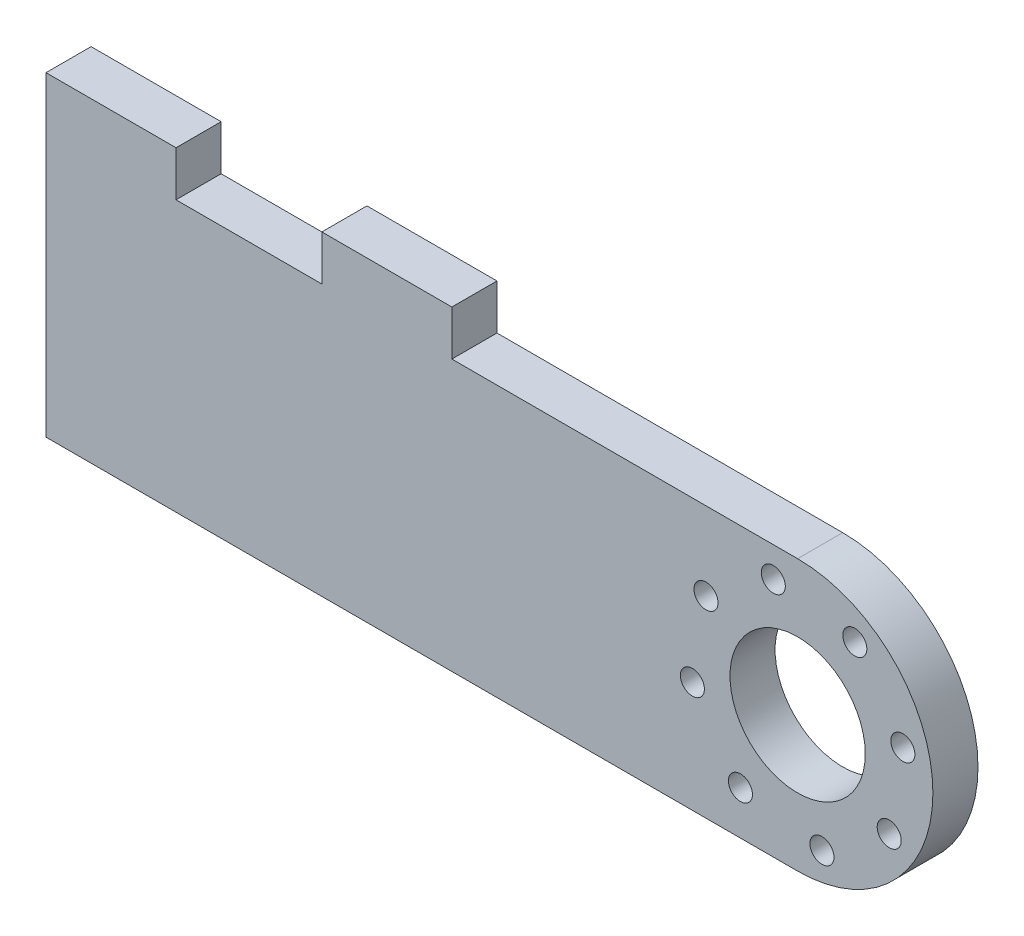
from build123d import *

# Parameters (mm, degrees)
ESQUISSE1_R        = 4.5
ESQUISSE1_R_2      = 0.8
BOSS_EXTRU_1_DEPTH = 3


with BuildPart() as part:
    # Esquisse1 → Boss.-Extru.1 (new body)
    with BuildSketch(Plane.XY):
        with BuildLine():
            Line((1.597834667, 9), (24.597834667, 9))
            ThreePointArc((24.597834667, 9), (33.597834667, 0), (24.597834667, -9))
            Line((24.597834667, -9), (-25.402165333, -9))
            Line((-25.402165333, -9), (-25.402165333, 12))
            Line((-25.402165333, 12), (-16.752165333, 12))
            Line((-16.752165333, 12), (-16.752165333, 9))
            Line((-16.752165333, 9), (-7.052165333, 9))
            Line((-7.052165333, 9), (-7.052165333, 12))
            Line((-7.052165333, 12), (1.597834667, 12))
            Line((1.597834667, 12), (1.597834667, 9))
        make_face()
        with Locations((24.597834667, 0)):
            Circle(ESQUISSE1_R, mode=Mode.SUBTRACT)
        with Locations((22.97907079, 7)):
            Circle(ESQUISSE1_R_2, mode=Mode.SUBTRACT)
        with Locations((28.402943221, 6.094386383)):
            Circle(ESQUISSE1_R_2, mode=Mode.SUBTRACT)
        with Locations((31.597834667, 1.618763877)):
            Circle(ESQUISSE1_R_2, mode=Mode.SUBTRACT)
        with Locations((30.69222105, -3.805108554)):
            Circle(ESQUISSE1_R_2, mode=Mode.SUBTRACT)
        with Locations((26.216598544, -7)):
            Circle(ESQUISSE1_R_2, mode=Mode.SUBTRACT)
        with Locations((20.792726113, -6.094386383)):
            Circle(ESQUISSE1_R_2, mode=Mode.SUBTRACT)
        with Locations((17.597834667, -1.618763877)):
            Circle(ESQUISSE1_R_2, mode=Mode.SUBTRACT)
        with Locations((18.503448284, 3.805108554)):
            Circle(ESQUISSE1_R_2, mode=Mode.SUBTRACT)
    extrude(amount=BOSS_EXTRU_1_DEPTH)


solid = part.part
